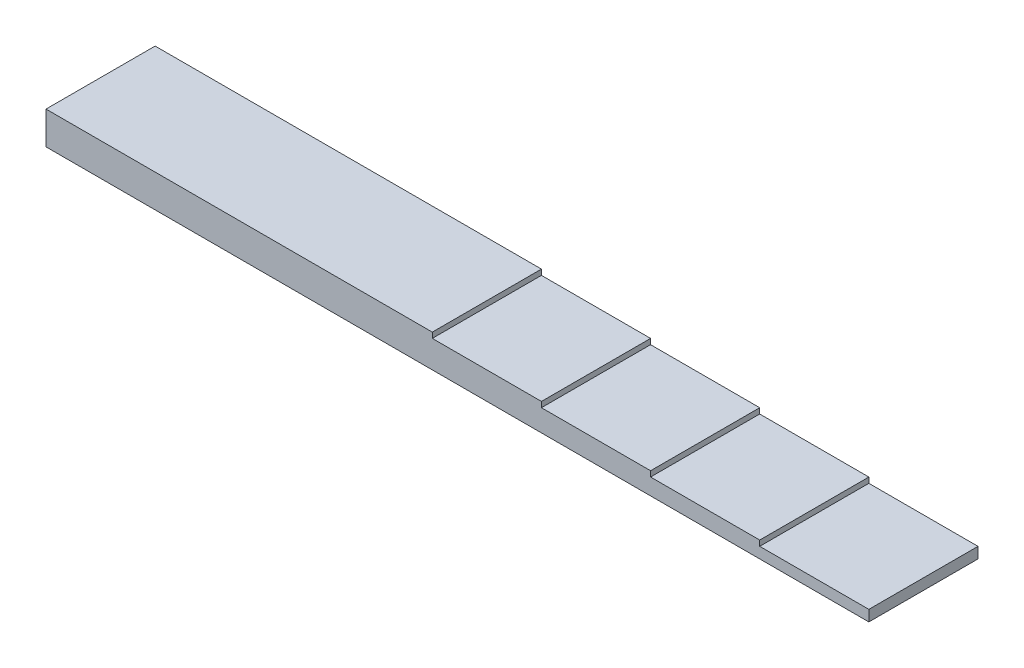
from build123d import *

# Parameters (mm, degrees)
BOSS_EXTRU_1_DEPTH = 10


with BuildPart() as part:
    # Esquisse1 → Boss.-Extru.1 (new body)
    with BuildSketch(Plane.XY):
        Polygon((2.288473993, -15.302499804), (12.288473993, -15.302499804), (12.288473993, -15.802499804), (22.288473993, -15.802499804), (22.288473993, -16.302499804), (32.288473993, -16.302499804), (32.288473993, -16.802499804), (42.288473993, -16.802499804), (42.288473993, -17.802499804), (32.288473993, -17.802499804), (22.288473993, -17.802499804), (12.288473993, -17.802499804), (2.288473993, -17.802499804), (-33.105569054, -17.802499804), (-33.105569054, -14.802499804), (2.288473993, -14.802499804), align=None)
    extrude(amount=BOSS_EXTRU_1_DEPTH)


solid = part.part
